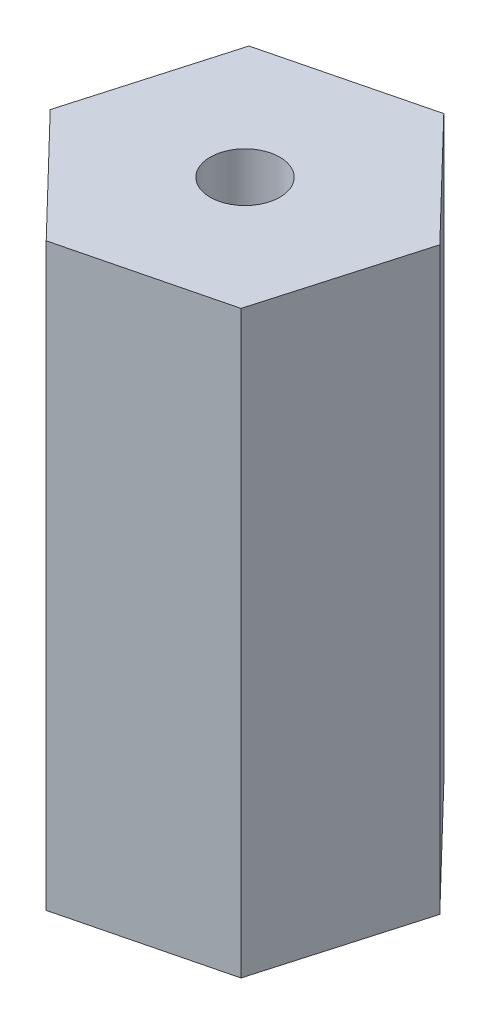
from build123d import *

# Parameters (mm, degrees)
RESSALTO_EXTRUS_O1_DEPTH = 25
ESBO_O2_R                = 1.5
CORTE_EXTRUS_O1_DEPTH    = 30


with BuildPart() as part:
    # Esboço1 → Ressalto-extrusão1 (new body)
    with BuildSketch(Plane(origin=(0, 0, 0), x_dir=(1, 0, 0), z_dir=(0, 1, 0))):
        Polygon((4.812291954, -4.984159523), (6.72255474, 1.675487321), (1.910262787, 6.659646844), (-4.812291954, 4.984159523), (-6.72255474, -1.675487321), (-1.910262787, -6.659646844), align=None)
    extrude(amount=RESSALTO_EXTRUS_O1_DEPTH)

    # Esboço2 → Corte-extrusão1 (cut)
    with BuildSketch(Plane.XZ):
        with Locations(Location((0, 0, 0), (0, 0, 270))):
            Circle(ESBO_O2_R)
    extrude(amount=-CORTE_EXTRUS_O1_DEPTH, mode=Mode.SUBTRACT)


solid = part.part
